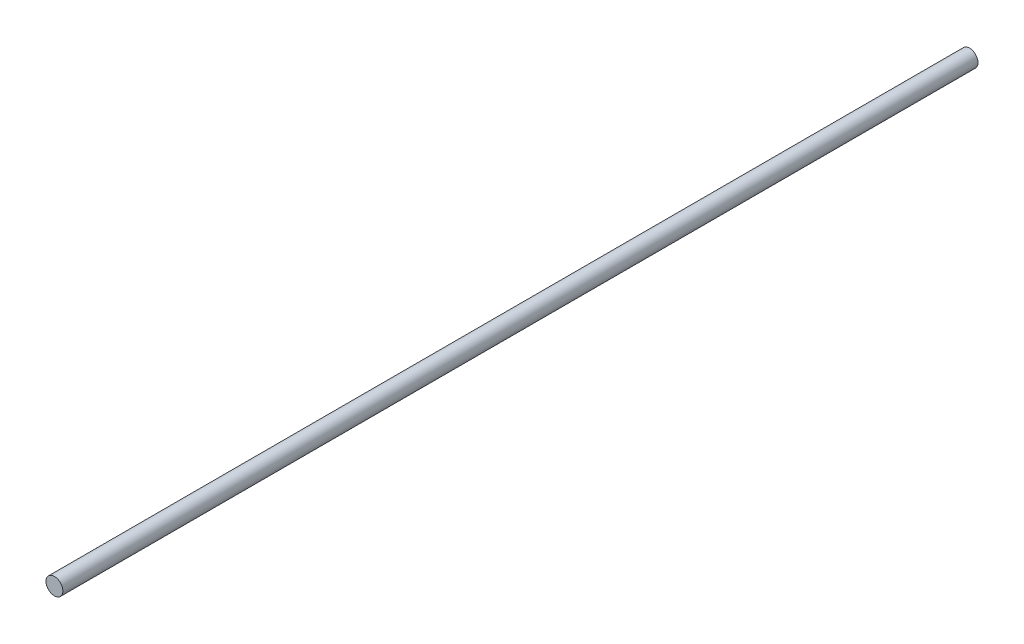
from build123d import *

# Parameters (mm, degrees)
SKETCH1_R           = 725.805
BOSS_EXTRUDE1_DEPTH = 78740
SCALE1_SCALE        = 0.039370079


with BuildPart() as part:
    # Sketch1 → Boss-Extrude1 (new body)
    with BuildSketch(Plane.XY):
        Circle(SKETCH1_R)
    extrude(amount=BOSS_EXTRUDE1_DEPTH)


with BuildPart() as part_1:
    # Scale1: scaled about (0, 0, 39370)
    add(part.part.scale(SCALE1_SCALE).moved(Location((0, 0, 37820))))


solid = part_1.part
